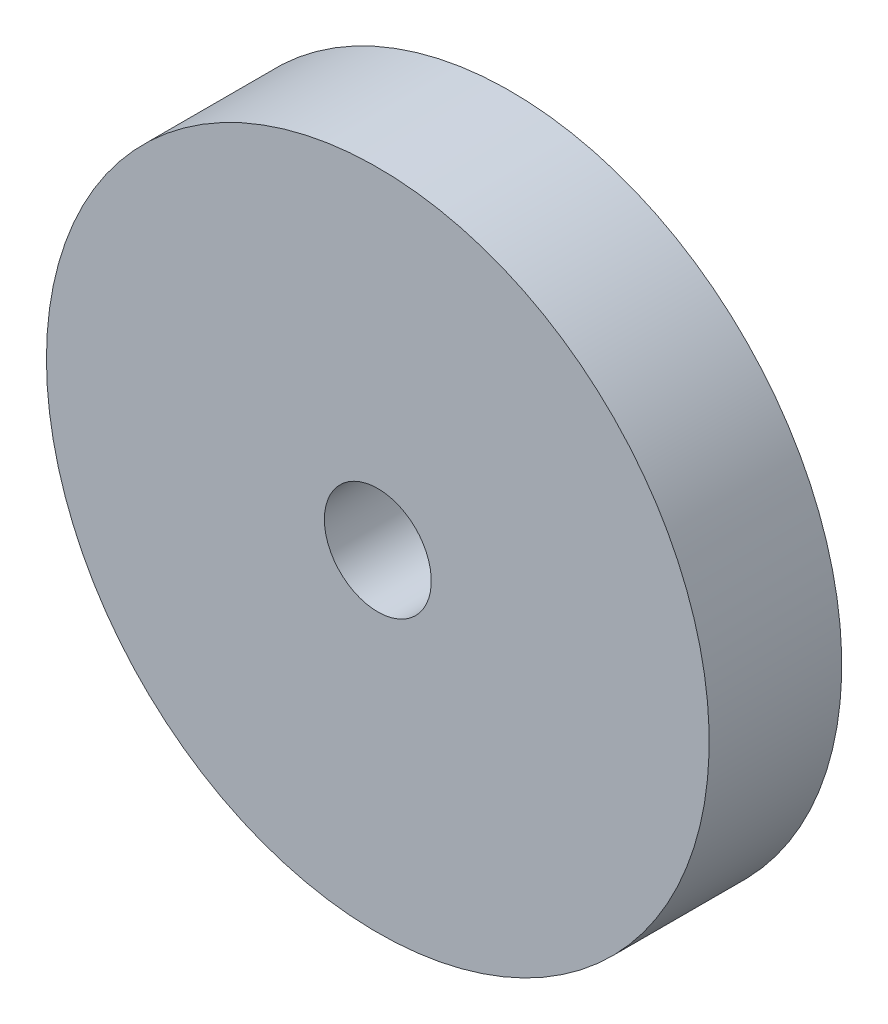
from build123d import *

# Parameters (mm, degrees)
SKETCH1_R           = 15.5
SKETCH1_R_2         = 2.5
BOSS_EXTRUDE1_DEPTH = 6.2


with BuildPart() as part:
    # Sketch1 → Boss-Extrude1 (new body)
    with BuildSketch(Plane.XY):
        with Locations(Location((0, 0, 0), (0, 0, 180))):
            Circle(SKETCH1_R)
        with Locations(Location((0, 0, 0), (0, 0, 180))):
            Circle(SKETCH1_R_2, mode=Mode.SUBTRACT)
    extrude(amount=BOSS_EXTRUDE1_DEPTH)


solid = part.part
